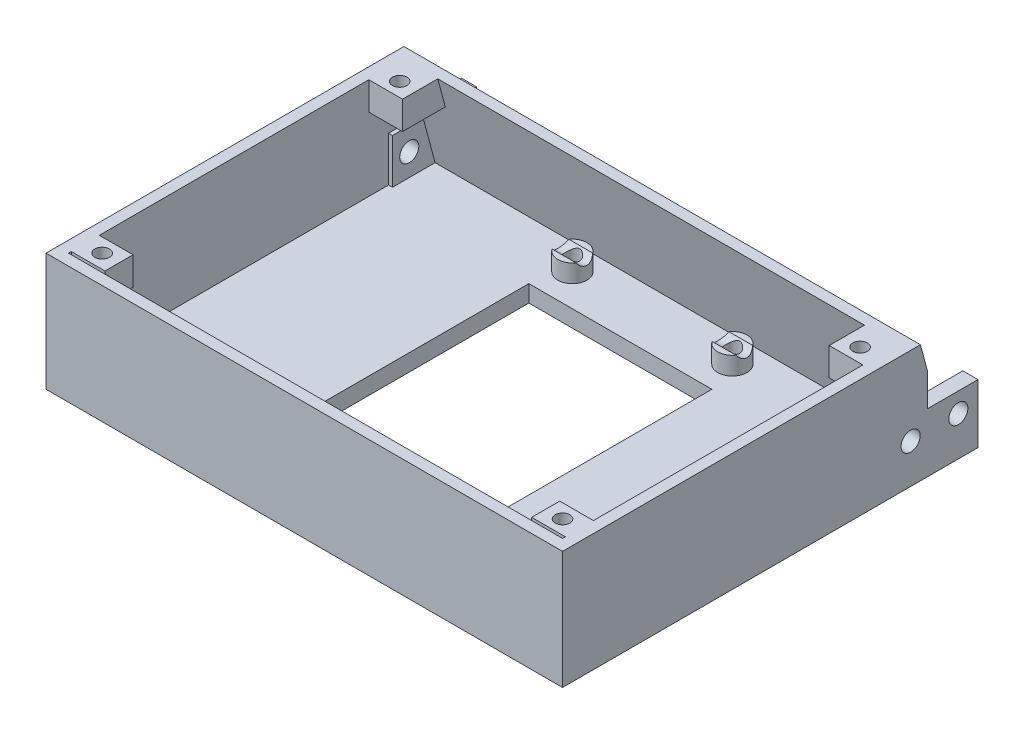
from build123d import *

# Parameters (mm, degrees)
SKETCH_1_W                                 = 92
SKETCH_1_H                                 = 3
FRONT_PANEL_1_DEPTH                        = 65
SKETCH_2_W                                 = 32.6
SKETCH_2_H                                 = 42.6
STEP_PORTRAIT_LCD_WINDOW_32_6X42_6_2_DEPTH = 5
SKETCH_3_R                                 = 3.3
BUTTON_BORE_3_DEPTH                        = 5
SKETCH_4_R                                 = 2.6
FOUR_M3_PCB_STANDOFFS_4_DEPTH              = 3.2
SKETCH_5_R                                 = 1.3
M3_PCB_MOUNT_PILOTS_52X28_5_5_DEPTH        = 9
SKETCH_6_W                                 = 2
SKETCH_6_H                                 = 18
HOUSING_LEFT_6_DEPTH                       = 65
SKETCH_7_W                                 = 2
SKETCH_7_H                                 = 18
HOUSING_RIGHT_7_DEPTH                      = 65
SKETCH_9_W                                 = 88
SKETCH_9_H                                 = 18
HOUSING_TOP_9_DEPTH                        = 2
SKETCH_10_W                                = 6
SKETCH_10_H                                = 5
COVER_POST_LB_10_DEPTH                     = 5
SKETCH_11_W                                = 6
SKETCH_11_H                                = 5
COVER_POST_RB_11_DEPTH                     = 5
SKETCH_12_W                                = 6
SKETCH_12_H                                = 5
COVER_POST_LT_12_DEPTH                     = 5
SKETCH_13_W                                = 6
SKETCH_13_H                                = 5
COVER_POST_RT_13_DEPTH                     = 5
SKETCH_15_W                                = 9
SKETCH_15_H                                = 8
BUTTON_LOWER_SHELF_15_DEPTH                = 2
SKETCH_16_W                                = 9
SKETCH_16_H                                = 8
BUTTON_UPPER_SHELF_16_DEPTH                = 2
SKETCH_17_R                                = 1.05
BUTTON_CARRIER_M2_PILOTS_17_DEPTH          = 10
SKETCH_18_W                                = 2.7
SKETCH_18_H                                = 10.5
RIGHT_TILT_EAR_18_DEPTH                    = 15
SKETCH_19_W                                = 2.7
SKETCH_19_H                                = 11
LEFT_TILT_EAR_19_DEPTH                     = 15
SKETCH_20_R                                = 1.7
M3_HINGE_AND_ANGLE_LOCK_20_DEPTH           = 94
SKETCH_21_W                                = 92
SKETCH_21_H                                = 3
FRONT_LOWER_EXTENSION_201_DEPTH            = 3
HOUSING_CAGE_ROOF_CLEARANCE_202_DEPTH      = 94
HORIZONTAL_ENCLOSURE_FLOOR_203_DEPTH       = 88
SKETCH_24_W                                = 6
SKETCH_24_H                                = 5
COVER_LOWER_POST_L_204_DEPTH               = 5
SKETCH_25_W                                = 6
SKETCH_25_H                                = 5
COVER_LOWER_POST_R_205_DEPTH               = 5
SKETCH_26_R                                = 1.3
REAR_COVER_M3_PILOTS_FINAL_206_DEPTH       = 8


with BuildPart() as part:
    # Эскиз1 → Front_panel_1 (new body)
    with BuildSketch(Plane.XY.offset(55)):
        with Locations((0, -65.5)):
            Rectangle(SKETCH_1_W, SKETCH_1_H)
    extrude(amount=FRONT_PANEL_1_DEPTH)

    # Эскиз2 → STEP_portrait_LCD_window_32_6x42_6_2 (cut)
    with BuildSketch(Plane(origin=(0, -68, 0), x_dir=(1, 0, 0), z_dir=(0, 1, 0))):
        with Locations((0, -85)):
            Rectangle(SKETCH_2_W, SKETCH_2_H)
    extrude(amount=STEP_PORTRAIT_LCD_WINDOW_32_6X42_6_2_DEPTH, mode=Mode.SUBTRACT)

    # Эскиз3 → Button_bore_3 (cut)
    with BuildSketch(Plane(origin=(0, -68, 0), x_dir=(1, 0, 0), z_dir=(0, 1, 0))):
        with Locations(Location((38, -77, 0), (0, 0, 90))):
            Circle(SKETCH_3_R)
    extrude(amount=BUTTON_BORE_3_DEPTH, mode=Mode.SUBTRACT)

    # Эскиз4 → Four_M3_PCB_standoffs_4 (add)
    with BuildSketch(Plane(origin=(0, -64, 0), x_dir=(1, 0, 0), z_dir=(0, 1, 0))):
        with Locations(Location((-14.25, -58, 0), (0, 0, 90))):
            Circle(SKETCH_4_R)
        with Locations(Location((-14.25, -110, 0), (0, 0, 90))):
            Circle(SKETCH_4_R)
        with Locations(Location((14.25, -58, 0), (0, 0, 90))):
            Circle(SKETCH_4_R)
        with Locations(Location((14.25, -110, 0), (0, 0, 90))):
            Circle(SKETCH_4_R)
    extrude(amount=FOUR_M3_PCB_STANDOFFS_4_DEPTH)

    # Эскиз5 → M3_PCB_mount_pilots_52x28_5_5 (cut)
    with BuildSketch(Plane(origin=(0, -68, 0), x_dir=(1, 0, 0), z_dir=(0, 1, 0))):
        with Locations(Location((-14.25, -58, 0), (0, 0, 270))):
            Circle(SKETCH_5_R)
        with Locations(Location((14.25, -58, 0), (0, 0, 270))):
            Circle(SKETCH_5_R)
        with Locations(Location((-14.25, -110, 0), (0, 0, 270))):
            Circle(SKETCH_5_R)
        with Locations(Location((14.25, -110, 0), (0, 0, 270))):
            Circle(SKETCH_5_R)
    extrude(amount=M3_PCB_MOUNT_PILOTS_52X28_5_5_DEPTH, mode=Mode.SUBTRACT)

    # Эскиз6 → Housing_left_6 (add)
    with BuildSketch(Plane.XY.offset(55)):
        with Locations((-45, -55)):
            Rectangle(SKETCH_6_W, SKETCH_6_H)
    extrude(amount=HOUSING_LEFT_6_DEPTH)

    # Эскиз7 → Housing_right_7 (add)
    with BuildSketch(Plane.XY.offset(55)):
        with Locations((45, -55)):
            Rectangle(SKETCH_7_W, SKETCH_7_H)
    extrude(amount=HOUSING_RIGHT_7_DEPTH)

    # Эскиз9 → Housing_top_9 (add)
    with BuildSketch(Plane.XY.offset(118)):
        with Locations((0, -55)):
            Rectangle(SKETCH_9_W, SKETCH_9_H)
    extrude(amount=HOUSING_TOP_9_DEPTH)

    # Эскиз10 → Cover_post_LB_10 (add)
    with BuildSketch(Plane.XY.offset(55.5)):
        with Locations((-41, -48.5)):
            Rectangle(SKETCH_10_W, SKETCH_10_H)
    extrude(amount=COVER_POST_LB_10_DEPTH)

    # Эскиз11 → Cover_post_RB_11 (add)
    with BuildSketch(Plane.XY.offset(55.5)):
        with Locations((41, -48.5)):
            Rectangle(SKETCH_11_W, SKETCH_11_H)
    extrude(amount=COVER_POST_RB_11_DEPTH)

    # Эскиз12 → Cover_post_LT_12 (add)
    with BuildSketch(Plane.XY.offset(112.5)):
        with Locations((-41, -48.5)):
            Rectangle(SKETCH_12_W, SKETCH_12_H)
    extrude(amount=COVER_POST_LT_12_DEPTH)

    # Эскиз13 → Cover_post_RT_13 (add)
    with BuildSketch(Plane.XY.offset(112.5)):
        with Locations((41, -48.5)):
            Rectangle(SKETCH_13_W, SKETCH_13_H)
    extrude(amount=COVER_POST_RT_13_DEPTH)

    # Эскиз15 → Button_lower_shelf_15 (add)
    with BuildSketch(Plane.XY.offset(68)):
        with Locations((38.5, -60)):
            Rectangle(SKETCH_15_W, SKETCH_15_H)
    extrude(amount=BUTTON_LOWER_SHELF_15_DEPTH)

    # Эскиз16 → Button_upper_shelf_16 (add)
    with BuildSketch(Plane.XY.offset(84)):
        with Locations((38.5, -60)):
            Rectangle(SKETCH_16_W, SKETCH_16_H)
    extrude(amount=BUTTON_UPPER_SHELF_16_DEPTH)

    # Эскиз17 → Button_carrier_M2_pilots_17 (cut)
    with BuildSketch(Plane(origin=(0, -65, 0), x_dir=(1, 0, 0), z_dir=(0, 1, 0))):
        with Locations(Location((36, -69, 0), (0, 0, 72.247209838))):
            Circle(SKETCH_17_R)
        with Locations(Location((41, -85, 0), (0, 0, 72.247209838))):
            Circle(SKETCH_17_R)
    extrude(amount=BUTTON_CARRIER_M2_PILOTS_17_DEPTH, mode=Mode.SUBTRACT)

    # Эскиз18 → Right_tilt_ear_18 (add)
    with BuildSketch(Plane.XY.offset(46)):
        with Locations((44.65, -61.75)):
            Rectangle(SKETCH_18_W, SKETCH_18_H)
    extrude(amount=RIGHT_TILT_EAR_18_DEPTH)

    # Эскиз19 → Left_tilt_ear_19 (add)
    with BuildSketch(Plane.XY.offset(46)):
        with Locations((-44.65, -61.5)):
            Rectangle(SKETCH_19_W, SKETCH_19_H)
    extrude(amount=LEFT_TILT_EAR_19_DEPTH)

    # Эскиз20 → M3_hinge_and_angle_lock_20 (cut)
    with BuildSketch(Plane(origin=(-47, 0, 0), x_dir=(0, 0, -1), z_dir=(1, 0, 0))):
        with Locations(Location((-49.5, -60, 0), (0, 0, 180))):
            Circle(SKETCH_20_R)
        with Locations(Location((-58, -60, 0), (0, 0, 180))):
            Circle(SKETCH_20_R)
    extrude(amount=M3_HINGE_AND_ANGLE_LOCK_20_DEPTH, mode=Mode.SUBTRACT)

    # Эскиз21 → Front_lower_extension_201 (add)
    with BuildSketch(Plane.XY.offset(52)):
        with Locations((0, -65.5)):
            Rectangle(SKETCH_21_W, SKETCH_21_H)
    extrude(amount=FRONT_LOWER_EXTENSION_201_DEPTH)

    # Эскиз22 → Housing_cage_roof_clearance_202 (cut)
    with BuildSketch(Plane(origin=(-47, 0, 0), x_dir=(0, 0, -1), z_dir=(1, 0, 0))):
        Polygon((-10, -55), (-10, -40), (-57.861284772, -40), (-53.842046885, -55), align=None)
    extrude(amount=HOUSING_CAGE_ROOF_CLEARANCE_202_DEPTH, mode=Mode.SUBTRACT)

    # Эскиз23 → Horizontal_enclosure_floor_203 (add)
    with BuildSketch(Plane(origin=(-44, 0, 0), x_dir=(0, 0, -1), z_dir=(1, 0, 0))):
        Polygon((-51.430504153, -64), (-56.253589617, -46), (-58.22061436, -46), (-53.397528896, -64), align=None)
    extrude(amount=HORIZONTAL_ENCLOSURE_FLOOR_203_DEPTH)

    # Эскиз24 → Cover_lower_post_L_204 (add)
    with BuildSketch(Plane.XY.offset(59.5)):
        with Locations((-41, -48.5)):
            Rectangle(SKETCH_24_W, SKETCH_24_H)
    extrude(amount=COVER_LOWER_POST_L_204_DEPTH)

    # Эскиз25 → Cover_lower_post_R_205 (add)
    with BuildSketch(Plane.XY.offset(59.5)):
        with Locations((41, -48.5)):
            Rectangle(SKETCH_25_W, SKETCH_25_H)
    extrude(amount=COVER_LOWER_POST_R_205_DEPTH)

    # Эскиз26 → Rear_cover_M3_pilots_final_206 (cut)
    with BuildSketch(Plane(origin=(0, -52, 0), x_dir=(1, 0, 0), z_dir=(0, 1, 0))):
        with Locations(Location((-41, -62, 0), (0, 0, 90))):
            Circle(SKETCH_26_R)
        with Locations(Location((41, -62, 0), (0, 0, 90))):
            Circle(SKETCH_26_R)
        with Locations(Location((-41, -115, 0), (0, 0, 90))):
            Circle(SKETCH_26_R)
        with Locations(Location((41, -115, 0), (0, 0, 90))):
            Circle(SKETCH_26_R)
    extrude(amount=REAR_COVER_M3_PILOTS_FINAL_206_DEPTH, mode=Mode.SUBTRACT)


solid = part.part
